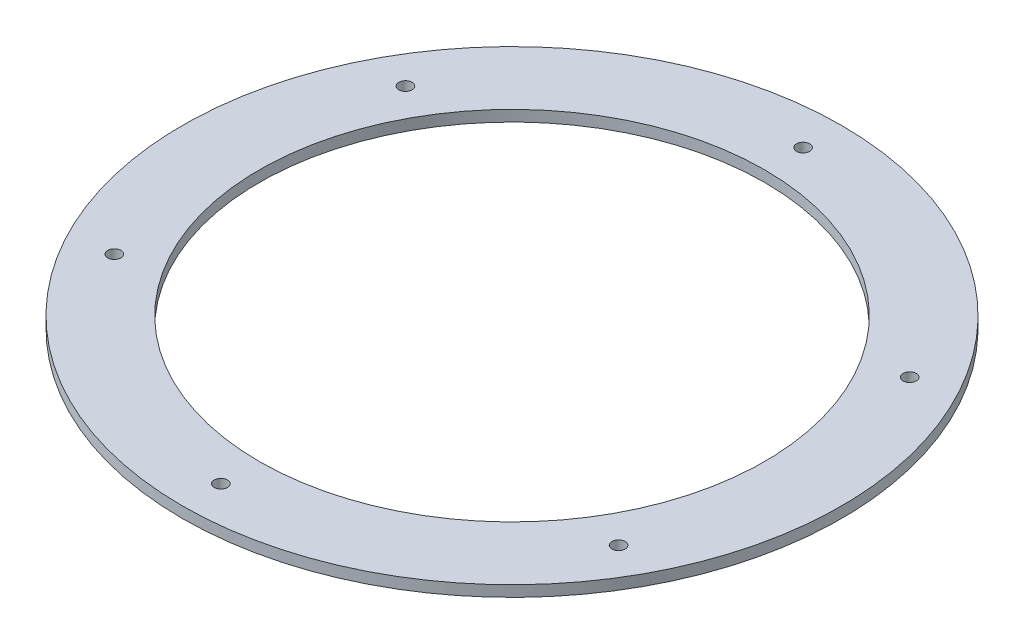
from build123d import *

# Parameters (mm, degrees)
SKETCH1_R           = 150
SKETCH1_R_2         = 115
SKETCH1_R_3         = 3
BOSS_EXTRUDE1_DEPTH = 5


with BuildPart() as part:
    # Sketch1 → Boss-Extrude1 (new body)
    with BuildSketch(Plane(origin=(0, 0, 0), x_dir=(1, 0, 0), z_dir=(0, 1, 0))):
        with Locations(Location((0, 0, 0), (0, 0, 270))):
            Circle(SKETCH1_R)
        with Locations(Location((0, 0, 0), (0, 0, 270))):
            Circle(SKETCH1_R_2, mode=Mode.SUBTRACT)
        with Locations(Location((0, 132.5, 0), (0, 0, 270))):
            Circle(SKETCH1_R_3, mode=Mode.SUBTRACT)
        with Locations(Location((114.748366001, 66.25, 0), (0, 0, 270))):
            Circle(SKETCH1_R_3, mode=Mode.SUBTRACT)
        with Locations(Location((114.748366001, -66.25, 0), (0, 0, 270))):
            Circle(SKETCH1_R_3, mode=Mode.SUBTRACT)
        with Locations(Location((0, -132.5, 0), (0, 0, 270))):
            Circle(SKETCH1_R_3, mode=Mode.SUBTRACT)
        with Locations(Location((-114.748366001, -66.25, 0), (0, 0, 270))):
            Circle(SKETCH1_R_3, mode=Mode.SUBTRACT)
        with Locations(Location((-114.748366001, 66.25, 0), (0, 0, 270))):
            Circle(SKETCH1_R_3, mode=Mode.SUBTRACT)
    extrude(amount=BOSS_EXTRUDE1_DEPTH)


solid = part.part
